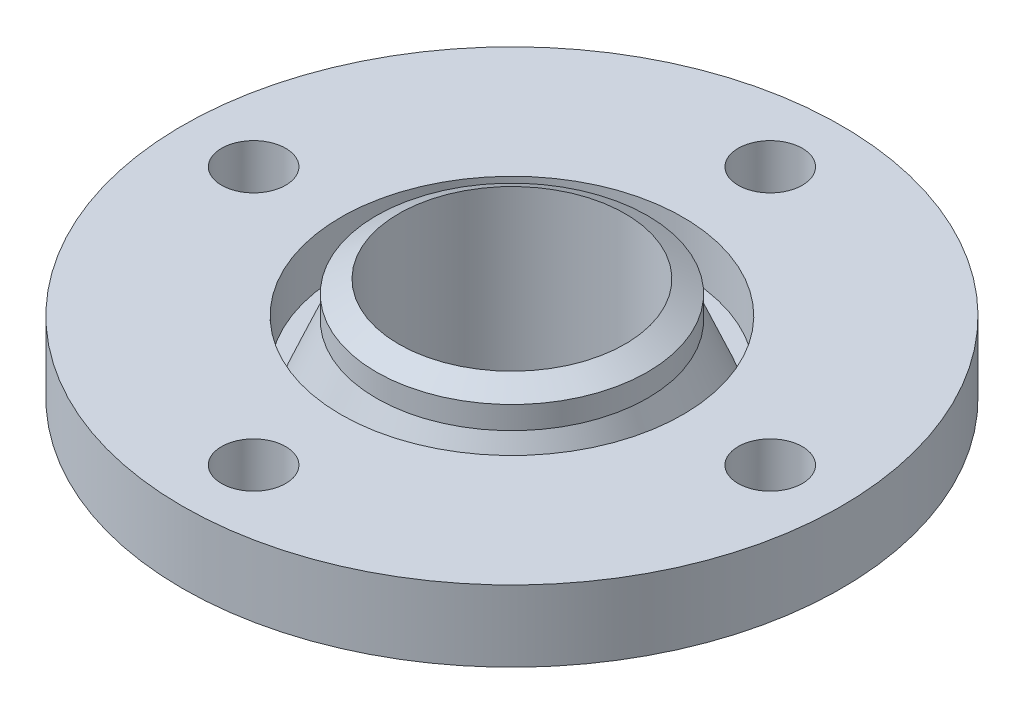
from build123d import *

# Parameters (mm, degrees)
SKETCH_2_W                 = 9
SKETCH_2_H                 = 22
PATTERN_CIRCULAR_886_COUNT = 4


with BuildPart() as part:
    # 1 → Revolve 120 (revolve)
    with BuildSketch(Plane.XY):
        Polygon((-31.75, 0), (-31.75, -45), (-59, -45), (-59, -29), (-92.5, -29), (-92.5, -9), (-48, -9), (-48, -23), (-54, -29), (-46, -29), (-38.05, -10), (-38.05, -3.637306696), align=None)
    revolve(axis=Axis((0, 0, 0), (0, -1, 0)))

    # 2 → 切除-旋转1 (revolve, cut)
    with BuildSketch(Plane.XY):
        with Locations((-77, -19)):
            Rectangle(SKETCH_2_W, SKETCH_2_H)
    cut_revolve_1 = revolve(axis=Axis((-72.5, 10.805368121, 0), (0, -1, 0)), mode=Mode.SUBTRACT)

    # Pattern Circular 886: 切除-旋转1 ×4 about axis
    pattern_circular_886_axis = Axis((0, 0, 0), (0, -1, 0))
    for i in range(1, PATTERN_CIRCULAR_886_COUNT):
        add(cut_revolve_1.rotate(pattern_circular_886_axis, i * 360 / PATTERN_CIRCULAR_886_COUNT), mode=Mode.SUBTRACT)


solid = part.part
